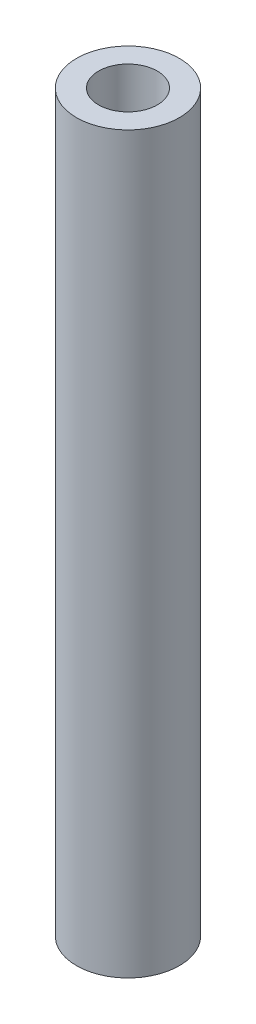
from build123d import *

# Parameters (mm, degrees)
SKETCH_1_R      = 3.5
SKETCH_1_R_2    = 2
EXTRUDE_1_DEPTH = 50


with BuildPart() as part:
    # 草图1 → 凸台-拉伸1 (new body)
    with BuildSketch(Plane(origin=(0, 0, 0), x_dir=(1, 0, 0), z_dir=(0, 1, 0))):
        with Locations(Location((0, 0, 0), (0, 0, 270))):
            Circle(SKETCH_1_R)
        with Locations(Location((0, 0, 0), (0, 0, 270))):
            Circle(SKETCH_1_R_2, mode=Mode.SUBTRACT)
    extrude(amount=EXTRUDE_1_DEPTH)


solid = part.part
